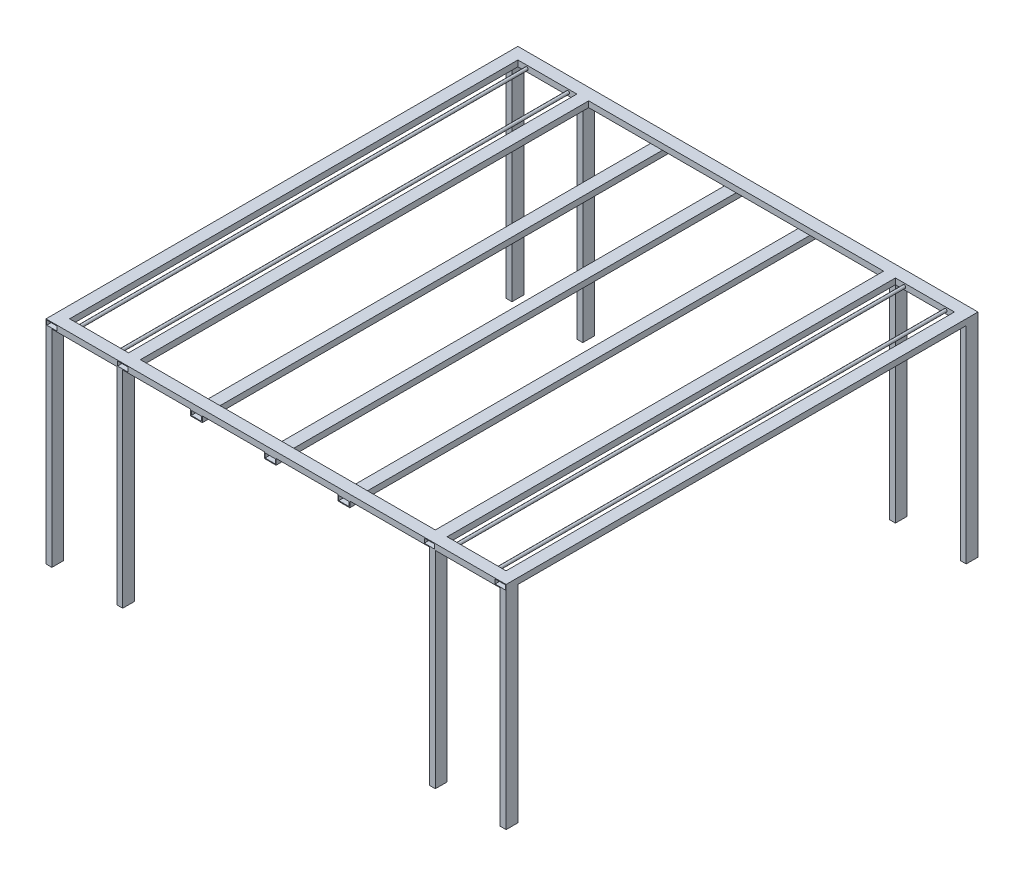
from build123d import *

# Parameters (mm, degrees)
SKETCH1_W            = 40
SKETCH1_H            = 20
SKETCH1_W_2          = 35
SKETCH1_H_2          = 15
BOSS_EXTRUDE1_DEPTH  = 1600
SKETCH2_W            = 40
SKETCH2_H            = 20
SKETCH2_W_2          = 35
SKETCH2_H_2          = 15
BOSS_EXTRUDE3_DEPTH  = 1000
SKETCH3_W            = 40
SKETCH3_H            = 20
SKETCH3_W_2          = 35
SKETCH3_H_2          = 15
BOSS_EXTRUDE4_DEPTH  = 1600
SKETCH4_W            = 20
SKETCH4_H            = 40
SKETCH4_W_2          = 15
SKETCH4_H_2          = 35
BOSS_EXTRUDE5_DEPTH  = 700
SKETCH5_W            = 40
SKETCH5_H            = 20
SKETCH5_W_2          = 35
SKETCH5_H_2          = 15
BOSS_EXTRUDE6_DEPTH  = 1600
SKETCH7_W            = 40
SKETCH7_H            = 20
SKETCH7_W_2          = 35
SKETCH7_H_2          = 15
BOSS_EXTRUDE7_DEPTH  = 200
SKETCH10_W           = 40
SKETCH10_H           = 20
SKETCH10_W_2         = 35
SKETCH10_H_2         = 15
BOSS_EXTRUDE9_DEPTH  = 200
SKETCH11_W           = 40
SKETCH11_H           = 20
SKETCH11_W_2         = 35
SKETCH11_H_2         = 15
BOSS_EXTRUDE10_DEPTH = 1600
SKETCH12_W           = 20
SKETCH12_H           = 40
SKETCH12_W_2         = 15
SKETCH12_H_2         = 35
BOSS_EXTRUDE11_DEPTH = 700
SKETCH14_R           = 5
BOSS_EXTRUDE13_DEPTH = 1550


with BuildPart() as part:
    # Sketch1 → Boss-Extrude1 (new body)
    with BuildSketch(Plane.XY):
        Rectangle(SKETCH1_W, SKETCH1_H)
        Rectangle(SKETCH1_W_2, SKETCH1_H_2, mode=Mode.SUBTRACT)
    extrude(amount=BOSS_EXTRUDE1_DEPTH)

    # Sketch2 → Boss-Extrude3 (add)
    # profile 1 of 2: a face of its own
    with BuildSketch(Plane(origin=(20, 0, 0), x_dir=(0, 0, -1), z_dir=(1, 0, 0))):
        with Locations((-1580, 0)):
            Rectangle(SKETCH2_W, SKETCH2_H)
        with Locations((-1580, 0)):
            Rectangle(SKETCH2_W_2, SKETCH2_H_2, mode=Mode.SUBTRACT)
    # profile 2 of 2: a face of its own
    with BuildSketch(Plane(origin=(20, 0, 0), x_dir=(0, 0, -1), z_dir=(1, 0, 0))):
        with Locations((-20, 0)):
            Rectangle(SKETCH2_W, SKETCH2_H)
        with Locations((-20, 0)):
            Rectangle(SKETCH2_W_2, SKETCH2_H_2, mode=Mode.SUBTRACT)
    extrude(amount=BOSS_EXTRUDE3_DEPTH)

    # Sketch3 → Boss-Extrude4 (add)
    with BuildSketch(Plane.XY.offset(1600)):
        with Locations((1040, 0)):
            Rectangle(SKETCH3_W, SKETCH3_H)
        with Locations((1040, 0)):
            Rectangle(SKETCH3_W_2, SKETCH3_H_2, mode=Mode.SUBTRACT)
    extrude(amount=-BOSS_EXTRUDE4_DEPTH)

    # Sketch4 → Boss-Extrude5 (add)
    # profile 1 of 4: a face of its own
    with BuildSketch(Plane.XZ.offset(10)):
        with Locations((1050, 1580)):
            Rectangle(SKETCH4_W, SKETCH4_H)
        with Locations((1050, 1580)):
            Rectangle(SKETCH4_W_2, SKETCH4_H_2, mode=Mode.SUBTRACT)
    # profile 2 of 4: a face of its own
    with BuildSketch(Plane.XZ.offset(10)):
        with Locations((1050, 20)):
            Rectangle(SKETCH4_W, SKETCH4_H)
        with Locations((1050, 20)):
            Rectangle(SKETCH4_W_2, SKETCH4_H_2, mode=Mode.SUBTRACT)
    # profile 3 of 4: a face of its own
    with BuildSketch(Plane.XZ.offset(10)):
        with Locations((-10, 20)):
            Rectangle(SKETCH4_W, SKETCH4_H)
        with Locations((-10, 20)):
            Rectangle(SKETCH4_W_2, SKETCH4_H_2, mode=Mode.SUBTRACT)
    # profile 4 of 4: a face of its own
    with BuildSketch(Plane.XZ.offset(10)):
        with Locations((-10, 1580)):
            Rectangle(SKETCH4_W, SKETCH4_H)
        with Locations((-10, 1580)):
            Rectangle(SKETCH4_W_2, SKETCH4_H_2, mode=Mode.SUBTRACT)
    extrude(amount=BOSS_EXTRUDE5_DEPTH)

    # Sketch5 → Boss-Extrude6 (add)
    # profile 1 of 3: a face of its own
    with BuildSketch(Plane.XY.offset(1600)):
        with Locations((250, -20)):
            Rectangle(SKETCH5_W, SKETCH5_H)
        with Locations((250, -20)):
            Rectangle(SKETCH5_W_2, SKETCH5_H_2, mode=Mode.SUBTRACT)
    # profile 2 of 3: a face of its own
    with BuildSketch(Plane.XY.offset(1600)):
        with Locations((500, -20)):
            Rectangle(SKETCH5_W, SKETCH5_H)
        with Locations((500, -20)):
            Rectangle(SKETCH5_W_2, SKETCH5_H_2, mode=Mode.SUBTRACT)
    # profile 3 of 3: a face of its own
    with BuildSketch(Plane.XY.offset(1600)):
        with Locations((750, -20)):
            Rectangle(SKETCH5_W, SKETCH5_H)
        with Locations((750, -20)):
            Rectangle(SKETCH5_W_2, SKETCH5_H_2, mode=Mode.SUBTRACT)
    extrude(amount=-BOSS_EXTRUDE6_DEPTH)

    # Sketch7 → Boss-Extrude7 (add)
    # profile 1 of 2: a face of its own
    with BuildSketch(Plane(origin=(1060, 0, 0), x_dir=(0, 0, -1), z_dir=(1, 0, 0))):
        with Locations((-1580, 0)):
            Rectangle(SKETCH7_W, SKETCH7_H)
        with Locations((-1580, 0)):
            Rectangle(SKETCH7_W_2, SKETCH7_H_2, mode=Mode.SUBTRACT)
    # profile 2 of 2: a face of its own
    with BuildSketch(Plane(origin=(1060, 0, 0), x_dir=(0, 0, -1), z_dir=(1, 0, 0))):
        with Locations((-20, 0)):
            Rectangle(SKETCH7_W, SKETCH7_H)
        with Locations((-20, 0)):
            Rectangle(SKETCH7_W_2, SKETCH7_H_2, mode=Mode.SUBTRACT)
    extrude(amount=BOSS_EXTRUDE7_DEPTH)

    # Sketch10 → Boss-Extrude9 (add)
    # profile 1 of 2: a face of its own
    with BuildSketch(Plane.ZY.offset(20)):
        with Locations((20, 0)):
            Rectangle(SKETCH10_W, SKETCH10_H)
        with Locations((20, 0)):
            Rectangle(SKETCH10_W_2, SKETCH10_H_2, mode=Mode.SUBTRACT)
    # profile 2 of 2: a face of its own
    with BuildSketch(Plane.ZY.offset(20)):
        with Locations((1580, 0)):
            Rectangle(SKETCH10_W, SKETCH10_H)
        with Locations((1580, 0)):
            Rectangle(SKETCH10_W_2, SKETCH10_H_2, mode=Mode.SUBTRACT)
    extrude(amount=BOSS_EXTRUDE9_DEPTH)

    # Sketch11 → Boss-Extrude10 (add)
    # profile 1 of 2: a face of its own
    with BuildSketch(Plane(origin=(0, 0, 0), x_dir=(-1, 0, 0), z_dir=(0, 0, -1))):
        with Locations((240, 0)):
            Rectangle(SKETCH11_W, SKETCH11_H)
        with Locations((240, 0)):
            Rectangle(SKETCH11_W_2, SKETCH11_H_2, mode=Mode.SUBTRACT)
    # profile 2 of 2: a face of its own
    with BuildSketch(Plane(origin=(0, 0, 0), x_dir=(-1, 0, 0), z_dir=(0, 0, -1))):
        with Locations((-1280, 0)):
            Rectangle(SKETCH11_W, SKETCH11_H)
        with Locations((-1280, 0)):
            Rectangle(SKETCH11_W_2, SKETCH11_H_2, mode=Mode.SUBTRACT)
    extrude(amount=-BOSS_EXTRUDE10_DEPTH)

    # Sketch12 → Boss-Extrude11 (add)
    # profile 1 of 4: a face of its own
    with BuildSketch(Plane.XZ.offset(10)):
        with Locations((1290, 20)):
            Rectangle(SKETCH12_W, SKETCH12_H)
        with Locations((1290, 20)):
            Rectangle(SKETCH12_W_2, SKETCH12_H_2, mode=Mode.SUBTRACT)
    # profile 2 of 4: a face of its own
    with BuildSketch(Plane.XZ.offset(10)):
        with Locations((-250, 20)):
            Rectangle(SKETCH12_W, SKETCH12_H)
        with Locations((-250, 20)):
            Rectangle(SKETCH12_W_2, SKETCH12_H_2, mode=Mode.SUBTRACT)
    # profile 3 of 4: a face of its own
    with BuildSketch(Plane.XZ.offset(10)):
        with Locations((1290, 1580)):
            Rectangle(SKETCH12_W, SKETCH12_H)
        with Locations((1290, 1580)):
            Rectangle(SKETCH12_W_2, SKETCH12_H_2, mode=Mode.SUBTRACT)
    # profile 4 of 4: a face of its own
    with BuildSketch(Plane.XZ.offset(10)):
        with Locations((-250, 1580)):
            Rectangle(SKETCH12_W, SKETCH12_H)
        with Locations((-250, 1580)):
            Rectangle(SKETCH12_W_2, SKETCH12_H_2, mode=Mode.SUBTRACT)
    extrude(amount=BOSS_EXTRUDE11_DEPTH)

    # Sketch14 → Boss-Extrude13 (add)
    with BuildSketch(Plane(origin=(0, 0, 1560), x_dir=(-1, 0, 0), z_dir=(0, 0, -1))):
        with Locations(Location((-1230, 0, 0), (0, 0, 180))):
            Circle(SKETCH14_R)
        with Locations(Location((-1090, 0, 0), (0, 0, 180))):
            Circle(SKETCH14_R)
        with Locations((50, 0)):
            Circle(SKETCH14_R)
        with Locations((190, 0)):
            Circle(SKETCH14_R)
    extrude(amount=BOSS_EXTRUDE13_DEPTH)


solid = part.part
